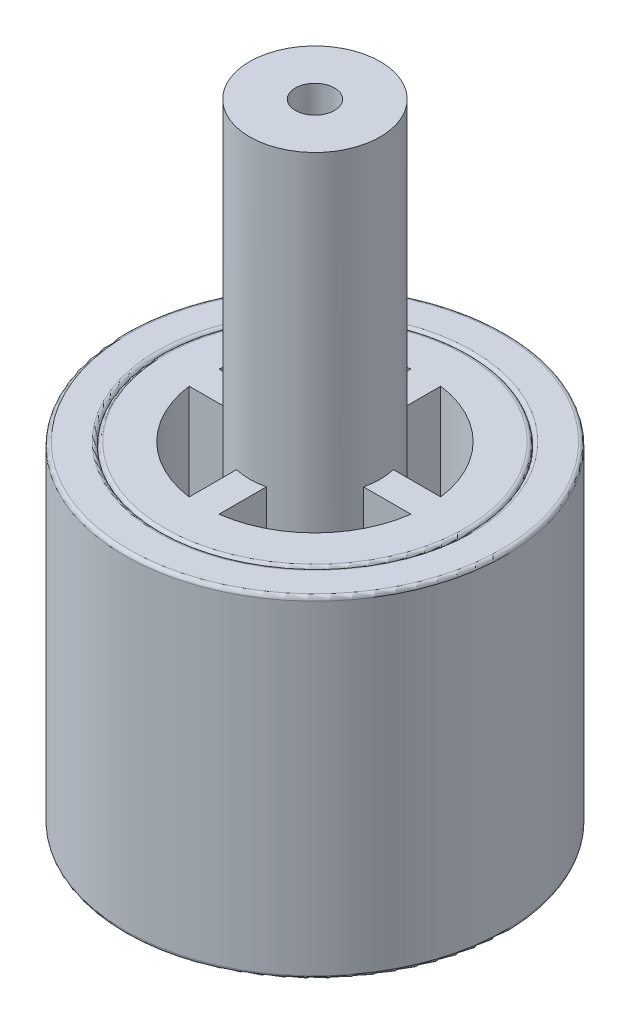
from build123d import *
from build123d.topology import SkipClean

# Parameters (mm, degrees)
SKETCH_1_R          = 4.125
EXTRUDE_1_DEPTH     = 8.9
SKETCH_2_R          = 1.75
EXTRUDE_2_DEPTH     = 7.95
CUT_EXTRUDE_START   = -3
CUT_EXTRUDE_1_DEPTH = 3
CUT_EXTRUDE_2_DEPTH = 3
SKETCH_5_R          = 0.525
CUT_EXTRUDE_3_DEPTH = 16.85
SKETCH_6_R          = 5.1
SKETCH_6_R_2        = 4.125
EXTRUDE_3_DEPTH     = 8.9
FILLET_1_R          = 0.1
FILLET_2_R          = 0.1


with BuildPart() as part:
    # Эскиз1 → Бобышка-Вытянуть1 (new body)
    with BuildSketch(Plane(origin=(0, 0, 0), x_dir=(1, 0, 0), z_dir=(0, 1, 0))):
        with Locations(Location((0, 0, 0), (0, 0, 270))):
            Circle(SKETCH_1_R)
    extrude(amount=EXTRUDE_1_DEPTH)

    # Эскиз2 → Бобышка-Вытянуть2 (add)
    with BuildSketch(Plane(origin=(0, 8.9, 0), x_dir=(1, 0, 0), z_dir=(0, 1, 0))):
        with Locations(Location((0, 0, 0), (0, 0, 270))):
            Circle(SKETCH_2_R)
    extrude(amount=EXTRUDE_2_DEPTH)

    # Эскиз3 → Вырез-Вытянуть1 (cut)
    with SkipClean():  # the faces are left unmerged after this step: merging them gives an invalid solid
        with BuildSketch(Plane(origin=(0, 8.9, 0), x_dir=(1, 0, 0), z_dir=(0, 1, 0)).offset(CUT_EXTRUDE_START)):
            with BuildLine():
                Line((-0.4, 2.973214), (-0.4, 1.703673))
                ThreePointArc((-0.4, 1.703673), (-1.237437, 1.237437), (-1.703673, 0.4))
                Line((-1.703673, 0.4), (-2.973214, 0.4))
                ThreePointArc((-2.973214, 0.4), (-2.12132, 2.12132), (-0.4, 2.973214))
            make_face()
            with BuildLine():
                Line((-2.973214, -0.4), (-1.703673, -0.4))
                ThreePointArc((-1.703673, -0.4), (-1.237437, -1.237437), (-0.4, -1.703673))
                Line((-0.4, -1.703673), (-0.4, -2.973214))
                ThreePointArc((-0.4, -2.973214), (-2.12132, -2.12132), (-2.973214, -0.4))
            make_face()
            with BuildLine():
                Line((0.4, 2.973214), (0.4, 1.703673))
                ThreePointArc((0.4, 1.703673), (1.237437, 1.237437), (1.703673, 0.4))
                Line((1.703673, 0.4), (2.973214, 0.4))
                ThreePointArc((2.973214, 0.4), (2.12132, 2.12132), (0.4, 2.973214))
            make_face()
            with BuildLine():
                Line((1.703673, -0.4), (2.973214, -0.4))
                ThreePointArc((2.973214, -0.4), (2.12132, -2.12132), (0.4, -2.973214))
                Line((0.4, -2.973214), (0.4, -1.703673))
                ThreePointArc((0.4, -1.703673), (1.237437, -1.237437), (1.703673, -0.4))
            make_face()
        extrude(amount=CUT_EXTRUDE_1_DEPTH, mode=Mode.SUBTRACT)

    # Эскиз4 → Вырез-Вытянуть2 (cut)
    with SkipClean():  # the faces are left unmerged after this step: merging them gives an invalid solid
        with BuildSketch(Plane.XZ):
            with BuildLine():
                Line((0.4, -1.703673), (0.4, -2.973214))
                ThreePointArc((0.4, -2.973214), (2.12132, -2.12132), (2.973214, -0.4))
                Line((2.973214, -0.4), (1.703673, -0.4))
                ThreePointArc((1.703673, -0.4), (1.237437, -1.237437), (0.4, -1.703673))
            make_face()
            with BuildLine():
                Line((0.4, 2.973214), (0.4, 1.703673))
                ThreePointArc((0.4, 1.703673), (1.237437, 1.237437), (1.703673, 0.4))
                Line((1.703673, 0.4), (2.973214, 0.4))
                ThreePointArc((2.973214, 0.4), (2.12132, 2.12132), (0.4, 2.973214))
            make_face()
            with BuildLine():
                Line((-2.973214, 0.4), (-1.703673, 0.4))
                ThreePointArc((-1.703673, 0.4), (-1.237437, 1.237437), (-0.4, 1.703673))
                Line((-0.4, 1.703673), (-0.4, 2.973214))
                ThreePointArc((-0.4, 2.973214), (-2.12132, 2.12132), (-2.973214, 0.4))
            make_face()
            with BuildLine():
                Line((-1.703673, -0.4), (-2.973214, -0.4))
                ThreePointArc((-2.973214, -0.4), (-2.12132, -2.12132), (-0.4, -2.973214))
                Line((-0.4, -2.973214), (-0.4, -1.703673))
                ThreePointArc((-0.4, -1.703673), (-1.237437, -1.237437), (-1.703673, -0.4))
            make_face()
        extrude(amount=-CUT_EXTRUDE_2_DEPTH, mode=Mode.SUBTRACT)

    # Эскиз5 → Вырез-Вытянуть3 (cut)
    with SkipClean():  # the faces are left unmerged after this step: merging them gives an invalid solid
        with BuildSketch(Plane.XZ):
            with Locations(Location((0, 0, 0), (0, 0, 270))):
                Circle(SKETCH_5_R)
        extrude(amount=-CUT_EXTRUDE_3_DEPTH, mode=Mode.SUBTRACT)

    # Скругление2
    fillet_2_edges = [part.edges().sort_by_distance(p)[0] for p in [
        (0, 0, -4.125),
        (0, 8.9, -4.125),
    ]]
    fillet(fillet_2_edges, radius=FILLET_2_R)


with BuildPart() as body_2:
    # Эскиз6 → Бобышка-Вытянуть3 (new body)
    with BuildSketch(Plane(origin=(0, 8.9, 0), x_dir=(1, 0, 0), z_dir=(0, 1, 0))):
        with Locations(Location((0, 0, 0), (0, 0, 270))):
            Circle(SKETCH_6_R)
        with Locations(Location((0, 0, 0), (0, 0, 270))):
            Circle(SKETCH_6_R_2, mode=Mode.SUBTRACT)
    extrude(amount=-EXTRUDE_3_DEPTH)

    # Скругление1
    fillet_1_edges = [body_2.edges().sort_by_distance(p)[0] for p in [
        (0, 8.9, -5.1),
        (0, 8.9, -4.125),
        (0, 0, -5.1),
        (0, 0, -4.125),
    ]]
    fillet(fillet_1_edges, radius=FILLET_1_R)


solid = Compound([part.part, body_2.part])
